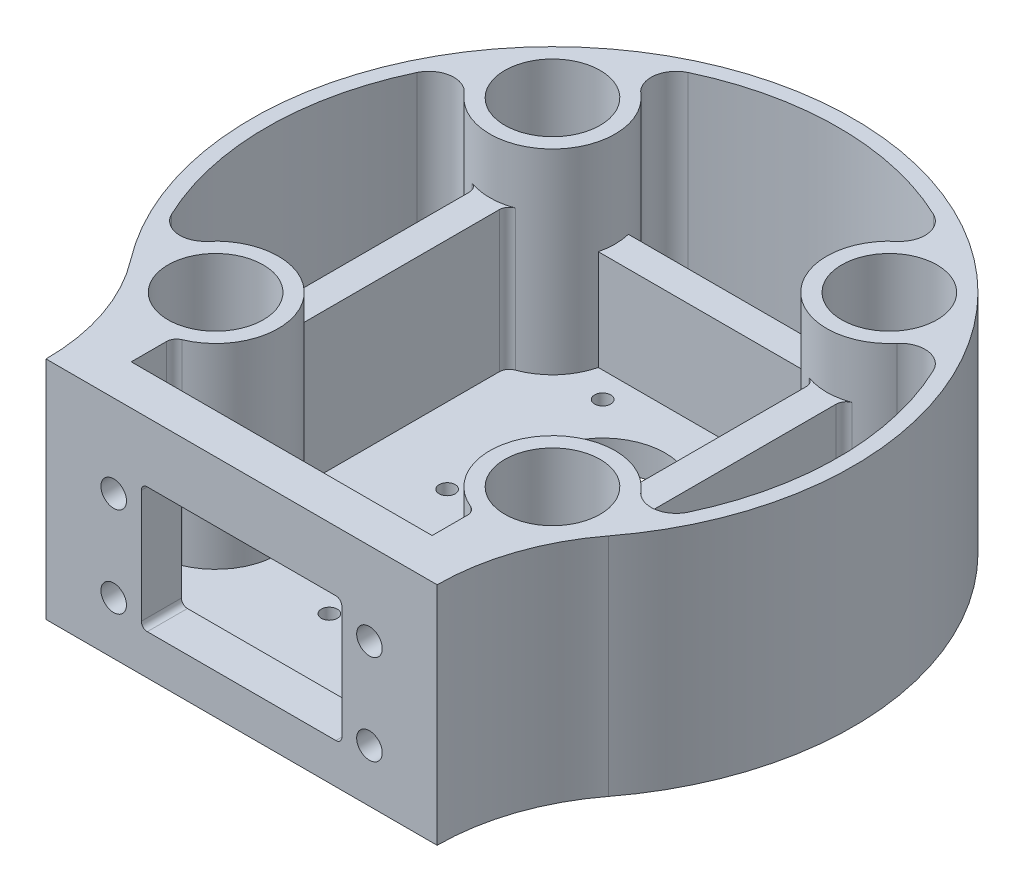
from build123d import *

# Parameters (mm, degrees)
SKETCH1_R           = 9.5
BOSS_EXTRUDE1_DEPTH = 45
BOSS_EXTRUDE2_DEPTH = 6
SKETCH3_R           = 5.25
SKETCH3_R_2         = 4.25
SKETCH3_R_3         = 1.6
CUT_EXTRUDE1_DEPTH  = 95.683683917
FILLET1_R           = 5
SKETCH4_R           = 5.1
CUT_EXTRUDE2_DEPTH  = 2
SKETCH5_R           = 12.5
SKETCH5_R_2         = 1.6
CUT_EXTRUDE3_DEPTH  = 98.308787031
CUT_EXTRUDE4_REACH  = 145.21
SKETCH6_W           = 40
SKETCH6_H           = 25
CUT_EXTRUDE5_REACH  = 145.21
SKETCH7_R           = 2.55
BOSS_EXTRUDE3_DEPTH = 28
FILLET2_R           = 2
BOSS_EXTRUDE4_DEPTH = 20
FILLET3_R           = 1.2


with BuildPart() as part:
    # Sketch1 → Boss-Extrude1 (new body)
    # profile 1 of 3: a face of its own
    with BuildSketch(Plane(origin=(0, 0, 0), x_dir=(1, 0, 0), z_dir=(0, 1, 0))):
        with BuildLine():
            ThreePointArc((-47.647058368, -36.465844689), (-41.21916632, -48.520286728), (-39, -62))
            Line((-39, -62), (39, -62))
            ThreePointArc((39, -62), (41.21916632, -48.520286728), (47.647058368, -36.465844689))
            ThreePointArc((47.647058368, -36.465844689), (0, 60), (-47.647058368, -36.465844689))
        make_face()
        with Locations(Location((-33.587572106, -33.587572106, 0), (0, 0, 90))):
            Circle(SKETCH1_R, mode=Mode.SUBTRACT)
        with Locations(Location((33.587572106, -33.587572106, 0), (0, 0, 90))):
            Circle(SKETCH1_R, mode=Mode.SUBTRACT)
        with BuildLine():
            Line((30, -54), (-30, -54))
            Line((-30, -54), (-30, -48.466483264))
            ThreePointArc((-30, -48.466483264), (-31.792352433, -47.310108082), (-33.540184508, -46.087482283))
            ThreePointArc((-33.540184508, -46.087482283), (-31.751176372, -45.951942317), (-30, -45.561682778))
            ThreePointArc((-30, -45.561682778), (-26.105156211, -23.574408152), (-46.087482283, -33.540184508))
            ThreePointArc((-46.087482283, -33.540184508), (-57, 0), (-46.087482283, 33.540184508))
            ThreePointArc((-46.087482283, 33.540184508), (-24.748737342, 24.748737342), (-33.540184508, 46.087482283))
            ThreePointArc((-33.540184508, 46.087482283), (0, 57), (33.540184508, 46.087482283))
            ThreePointArc((33.540184508, 46.087482283), (24.748737342, 24.748737342), (46.087482283, 33.540184508))
            ThreePointArc((46.087482283, 33.540184508), (57, 0), (46.087482283, -33.540184508))
            ThreePointArc((46.087482283, -33.540184508), (26.105156211, -23.574408152), (30, -45.561682778))
            ThreePointArc((30, -45.561682778), (31.751176372, -45.951942317), (33.540184508, -46.087482283))
            ThreePointArc((33.540184508, -46.087482283), (31.792352433, -47.310108082), (30, -48.466483264))
            Line((30, -48.466483264), (30, -54))
        make_face(mode=Mode.SUBTRACT)
        with Locations(Location((-33.587572106, 33.587572106, 0), (0, 0, 90))):
            Circle(SKETCH1_R, mode=Mode.SUBTRACT)
        with Locations(Location((33.587572106, 33.587572106, 0), (0, 0, 90))):
            Circle(SKETCH1_R, mode=Mode.SUBTRACT)
    # profile 2 of 3: a face of its own
    with BuildSketch(Plane(origin=(0, 0, 0), x_dir=(1, 0, 0), z_dir=(0, 1, 0))):
        with BuildLine():
            Line((30, -45.561682778), (30, -48.466483264))
            ThreePointArc((30, -48.466483264), (31.792352433, -47.310108082), (33.540184508, -46.087482283))
            ThreePointArc((33.540184508, -46.087482283), (31.751176372, -45.951942317), (30, -45.561682778))
        make_face()
    # profile 3 of 3: a face of its own
    with BuildSketch(Plane(origin=(0, 0, 0), x_dir=(1, 0, 0), z_dir=(0, 1, 0))):
        with BuildLine():
            ThreePointArc((-33.540184508, -46.087482283), (-31.792352433, -47.310108082), (-30, -48.466483264))
            Line((-30, -48.466483264), (-30, -45.561682778))
            ThreePointArc((-30, -45.561682778), (-31.751176372, -45.951942317), (-33.540184508, -46.087482283))
        make_face()
    extrude(amount=BOSS_EXTRUDE1_DEPTH)

    # Sketch2 → Boss-Extrude2 (add)
    with BuildSketch(Plane.XZ):
        with BuildLine():
            Line((39, 62), (-39, 62))
            ThreePointArc((-39, 62), (-41.21916632, 48.520286728), (-47.647058368, 36.465844689))
            ThreePointArc((-47.647058368, 36.465844689), (0, -60), (47.647058368, 36.465844689))
            ThreePointArc((47.647058368, 36.465844689), (41.21916632, 48.520286728), (39, 62))
        make_face()
    extrude(amount=-BOSS_EXTRUDE2_DEPTH)

    # Sketch3 → Cut-Extrude1 (cut, through all)
    with BuildSketch(Plane(origin=(0, 6, 0), x_dir=(1, 0, 0), z_dir=(0, 1, 0))):
        with Locations(Location((-33.587572106, 33.587572106, 0), (0, 0, 270))):
            Circle(SKETCH3_R)
        with Locations(Location((33.587572106, 33.587572106, 0), (0, 0, 270))):
            Circle(SKETCH3_R)
        with Locations(Location((33.587572106, -33.587572106, 0), (0, 0, 270))):
            Circle(SKETCH3_R)
        with Locations(Location((-33.587572106, -33.587572106, 0), (0, 0, 270))):
            Circle(SKETCH3_R)
        with Locations(Location((0, -33, 0), (0, 0, 270))):
            Circle(SKETCH3_R_2)
        with Locations(Location((-5.75, -27.25, 0), (0, 0, 270))):
            Circle(SKETCH3_R_3)
        with Locations(Location((5.75, -27.25, 0), (0, 0, 270))):
            Circle(SKETCH3_R_3)
        with Locations(Location((5.75, -38.75, 0), (0, 0, 270))):
            Circle(SKETCH3_R_3)
        with Locations(Location((-5.75, -38.75, 0), (0, 0, 270))):
            Circle(SKETCH3_R_3)
    extrude(amount=-CUT_EXTRUDE1_DEPTH, mode=Mode.SUBTRACT)

    # Fillet1
    fillet1_edges = [part.edges().sort_by_distance(p)[0] for p in [
        (46.087482283, 25.5, 33.540184508),
        (46.087482283, 25.5, -33.540184508),
        (33.540184508, 25.5, -46.087482283),
        (-33.540184508, 25.5, -46.087482283),
        (-46.087482283, 25.5, -33.540184508),
        (-46.087482283, 25.5, 33.540184508),
    ]]
    fillet(fillet1_edges, radius=FILLET1_R)

    # Sketch4 → Cut-Extrude2 (cut)
    with BuildSketch(Plane(origin=(0, 6, 0), x_dir=(1, 0, 0), z_dir=(0, 1, 0))):
        with Locations(Location((0, -33, 0), (0, 0, 270))):
            Circle(SKETCH4_R)
    extrude(amount=-CUT_EXTRUDE2_DEPTH, mode=Mode.SUBTRACT)

    # Sketch5 → Cut-Extrude3 (cut, through all)
    with BuildSketch(Plane.XZ):
        with Locations(Location((0, -10, 0), (0, 0, 270))):
            Circle(SKETCH5_R)
        with Locations(Location((15.5, 5.5, 0), (0, 0, 270))):
            Circle(SKETCH5_R_2)
        with Locations(Location((-15.5, 5.5, 0), (0, 0, 270))):
            Circle(SKETCH5_R_2)
        with Locations(Location((-15.5, -25.5, 0), (0, 0, 270))):
            Circle(SKETCH5_R_2)
        with Locations(Location((15.5, -25.5, 0), (0, 0, 270))):
            Circle(SKETCH5_R_2)
    extrude(amount=-CUT_EXTRUDE3_DEPTH, mode=Mode.SUBTRACT)

    # Sketch6 → Cut-Extrude4 (cut, up to next)
    with BuildSketch(Plane.XY.offset(62), mode=Mode.PRIVATE) as cut_extrude4_sk1:
        with Locations((0, 20.5)):
            Rectangle(SKETCH6_W, SKETCH6_H)
    cut_extrude4_tool1 = extrude(cut_extrude4_sk1.sketch, amount=-CUT_EXTRUDE4_REACH, mode=Mode.PRIVATE) & part.part
    add(cut_extrude4_tool1.solids().sort_by_distance((0, 20.5, 62))[0], mode=Mode.SUBTRACT)

    # Sketch7 → Cut-Extrude5 (cut, up to next)
    with BuildSketch(Plane.XY.offset(62), mode=Mode.PRIVATE) as cut_extrude5_sk1:
        with Locations((-25.5, 10.5)):
            Circle(SKETCH7_R)
    cut_extrude5_tool1 = extrude(cut_extrude5_sk1.sketch, amount=-CUT_EXTRUDE5_REACH, mode=Mode.PRIVATE) & part.part
    # Sketch7 → Cut-Extrude5 (cut, up to next)
    with BuildSketch(Plane.XY.offset(62), mode=Mode.PRIVATE) as cut_extrude5_sk2:
        with Locations((25.5, 10.5)):
            Circle(SKETCH7_R)
    cut_extrude5_tool2 = extrude(cut_extrude5_sk2.sketch, amount=-CUT_EXTRUDE5_REACH, mode=Mode.PRIVATE) & part.part
    # Sketch7 → Cut-Extrude5 (cut, up to next)
    with BuildSketch(Plane.XY.offset(62), mode=Mode.PRIVATE) as cut_extrude5_sk3:
        with Locations((25.5, 28.5)):
            Circle(SKETCH7_R)
    cut_extrude5_tool3 = extrude(cut_extrude5_sk3.sketch, amount=-CUT_EXTRUDE5_REACH, mode=Mode.PRIVATE) & part.part
    # Sketch7 → Cut-Extrude5 (cut, up to next)
    with BuildSketch(Plane.XY.offset(62), mode=Mode.PRIVATE) as cut_extrude5_sk4:
        with Locations((-25.5, 28.5)):
            Circle(SKETCH7_R)
    cut_extrude5_tool4 = extrude(cut_extrude5_sk4.sketch, amount=-CUT_EXTRUDE5_REACH, mode=Mode.PRIVATE) & part.part
    add(cut_extrude5_tool1.solids().sort_by_distance((-25.5, 10.5, 62))[0], mode=Mode.SUBTRACT)
    add(cut_extrude5_tool2.solids().sort_by_distance((25.5, 10.5, 62))[0], mode=Mode.SUBTRACT)
    add(cut_extrude5_tool3.solids().sort_by_distance((25.5, 28.5, 62))[0], mode=Mode.SUBTRACT)
    add(cut_extrude5_tool4.solids().sort_by_distance((-25.5, 28.5, 62))[0], mode=Mode.SUBTRACT)

    # Sketch8 → Boss-Extrude3 (add)
    with BuildSketch(Plane(origin=(0, 6, 0), x_dir=(1, 0, 0), z_dir=(0, 1, 0))):
        with BuildLine():
            Line((-36.587572106, 21.452911007), (-36.587572106, -21.452911007))
            ThreePointArc((-36.587572106, -21.452911007), (-33.587572106, -21.087572106), (-30.587572106, -21.452911007))
            Line((-30.587572106, -21.452911007), (-30.587572106, 21.452911007))
            ThreePointArc((-30.587572106, 21.452911007), (-33.587572106, 21.087572106), (-36.587572106, 21.452911007))
        make_face()
        with BuildLine():
            Line((30.587572106, 21.452911007), (30.587572106, -21.452911007))
            ThreePointArc((30.587572106, -21.452911007), (33.587572106, -21.087572106), (36.587572106, -21.452911007))
            Line((36.587572106, -21.452911007), (36.587572106, 21.452911007))
            ThreePointArc((36.587572106, 21.452911007), (33.587572106, 21.087572106), (30.587572106, 21.452911007))
        make_face()
    extrude(amount=BOSS_EXTRUDE3_DEPTH)

    # Fillet2
    fillet2_edges = [part.edges().sort_by_distance(p)[0] for p in [
        (-30.587572106, 20, -21.452911007),
        (-36.587572106, 20, -21.452911007),
        (-36.587572106, 20, 21.452911007),
        (-30.587572106, 20, 21.452911007),
        (30.587572106, 20, 21.452911007),
        (36.587572106, 20, 21.452911007),
        (36.587572106, 20, -21.452911007),
        (30.587572106, 20, -21.452911007),
        (30, 25.5, 45.561682778),
        (-30, 25.5, 45.561682778),
    ]]
    fillet(fillet2_edges, radius=FILLET2_R)

    # Sketch9 → Boss-Extrude4 (add)
    with BuildSketch(Plane(origin=(0, 6, 0), x_dir=(1, 0, 0), z_dir=(0, 1, 0))):
        with BuildLine():
            Line((-21.452911007, 30.587572106), (21.452911007, 30.587572106))
            ThreePointArc((21.452911007, 30.587572106), (21.087572106, 33.587572106), (21.452911007, 36.587572106))
            Line((21.452911007, 36.587572106), (-21.452911007, 36.587572106))
            ThreePointArc((-21.452911007, 36.587572106), (-21.087572106, 33.587572106), (-21.452911007, 30.587572106))
        make_face()
    extrude(amount=BOSS_EXTRUDE4_DEPTH)

    # Fillet3
    fillet3_edges = [part.edges().sort_by_distance(p)[0] for p in [
        (20, 33, 58),
        (20, 8, 58),
        (-20, 8, 58),
        (-20, 33, 58),
    ]]
    fillet(fillet3_edges, radius=FILLET3_R)


solid = part.part
